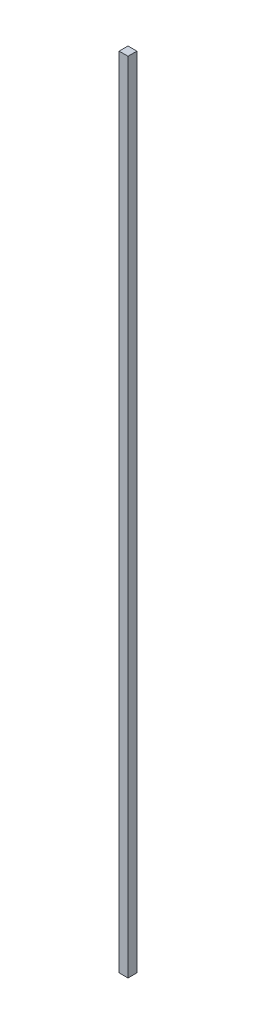
from build123d import *

# Parameters (mm, degrees)
SKETCH1_W           = 25.4
SKETCH1_H           = 25.4
BOSS_EXTRUDE1_DEPTH = 2286


with BuildPart() as part:
    # Sketch1 → Boss-Extrude1 (new body)
    with BuildSketch(Plane(origin=(0, 0, 0), x_dir=(1, 0, 0), z_dir=(0, 1, 0))):
        with Locations((12.7, -12.7)):
            Rectangle(SKETCH1_W, SKETCH1_H)
    extrude(amount=BOSS_EXTRUDE1_DEPTH)


solid = part.part
